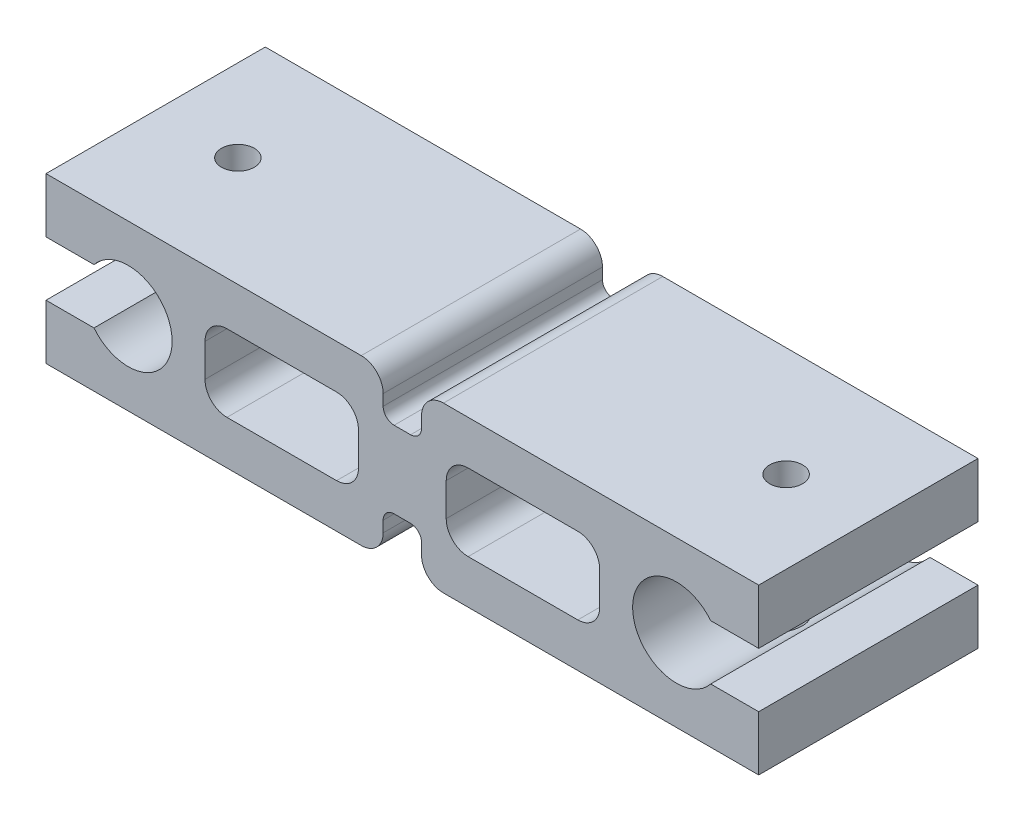
from build123d import *

# Parameters (mm, degrees)
SKETCH_1_R               = 4
EXTRUDE_1_DEPTH          = 20
SKETCH_2_W               = 14
SKETCH_2_H               = 7
SKETCH_2_W_2             = 3.5
SKETCH_2_H_2             = 4
CUT_EXTRUDE_1_DEPTH      = 39.890872965
FILLET_1_R               = 2
FILLET_2_R               = 2
FILLET_4_R               = 1
CUT_EXTRUDE_2_DEPTH      = 42.003048667
CUT_EXTRUDE_2_DEPTH_BACK = 42.003048667
SKETCH_4_R               = 1.5
SKETCH_5_W               = 4.377501001
SKETCH_5_H               = 5
CUT_EXTRUDE_3_DEPTH      = 39.890873036


with BuildPart() as part:
    # 草图1 → 凸台-拉伸1 (new body)
    with BuildSketch(Plane.XY):
        Polygon((-25, 7.5), (25, 7.5), (32.5, 7.5), (32.5, -7.5), (25, -7.5), (-25, -7.5), (-32.5, -7.5), (-32.5, 7.5), align=None)
        with Locations((-25, 0)):
            Circle(SKETCH_1_R, mode=Mode.SUBTRACT)
        with Locations((25, 0)):
            Circle(SKETCH_1_R, mode=Mode.SUBTRACT)
    extrude(amount=EXTRUDE_1_DEPTH)

    # 草图2 → 切除-拉伸1 (cut, through all)
    with BuildSketch(Plane.XY.offset(20)):
        with Locations((-11, 0)):
            Rectangle(SKETCH_2_W, SKETCH_2_H)
        with Locations((11, 0)):
            Rectangle(SKETCH_2_W, SKETCH_2_H)
        with Locations((0, 5.5)):
            Rectangle(SKETCH_2_W_2, SKETCH_2_H_2)
        with Locations((0, -5.5)):
            Rectangle(SKETCH_2_W_2, SKETCH_2_H_2)
    extrude(amount=-CUT_EXTRUDE_1_DEPTH, mode=Mode.SUBTRACT)

    # 圆角1
    fillet_1_edges = [part.edges().sort_by_distance(p)[0] for p in [
        (-1.75, 7.5, 10),
        (1.75, 7.5, 10),
        (-1.75, -7.5, 10),
        (1.75, -7.5, 10),
    ]]
    fillet(fillet_1_edges, radius=FILLET_1_R)

    # 圆角2
    fillet_2_edges = [part.edges().sort_by_distance(p)[0] for p in [
        (-4, 3.5, 10),
        (-4, -3.5, 10),
        (-18, -3.5, 10),
        (-18, 3.5, 10),
        (18, 3.5, 10),
        (18, -3.5, 10),
        (4, -3.5, 10),
        (4, 3.5, 10),
    ]]
    fillet(fillet_2_edges, radius=FILLET_2_R)

    # 圆角4
    fillet_4_edges = [part.edges().sort_by_distance(p)[0] for p in [
        (-1.75, 3.5, 10),
        (1.75, 3.5, 10),
        (-1.75, -3.5, 10),
        (1.75, -3.5, 10),
    ]]
    fillet(fillet_4_edges, radius=FILLET_4_R)

    # 草图4 → 切除-拉伸2 (cut, two sides: drawn at the far end of the back side and taken through both)
    with BuildSketch(Plane(origin=(0, 7.5, 0), x_dir=(1, 0, 0), z_dir=(0, 1, 0)).offset(-CUT_EXTRUDE_2_DEPTH_BACK)):
        with Locations(Location((-25, -10, 0), (0, 0, 180))):
            Circle(SKETCH_4_R)
        with Locations(Location((25, -10, 0), (0, 0, 180))):
            Circle(SKETCH_4_R)
    extrude(amount=CUT_EXTRUDE_2_DEPTH + CUT_EXTRUDE_2_DEPTH_BACK, mode=Mode.SUBTRACT)

    # 草图5 → 切除-拉伸3 (cut, through all)
    with BuildSketch(Plane.XY.offset(20)):
        with Locations((-30.3112495, 0)):
            Rectangle(SKETCH_5_W, SKETCH_5_H)
        with Locations((30.3112495, 0)):
            Rectangle(SKETCH_5_W, SKETCH_5_H)
    extrude(amount=-CUT_EXTRUDE_3_DEPTH, mode=Mode.SUBTRACT)


solid = part.part
